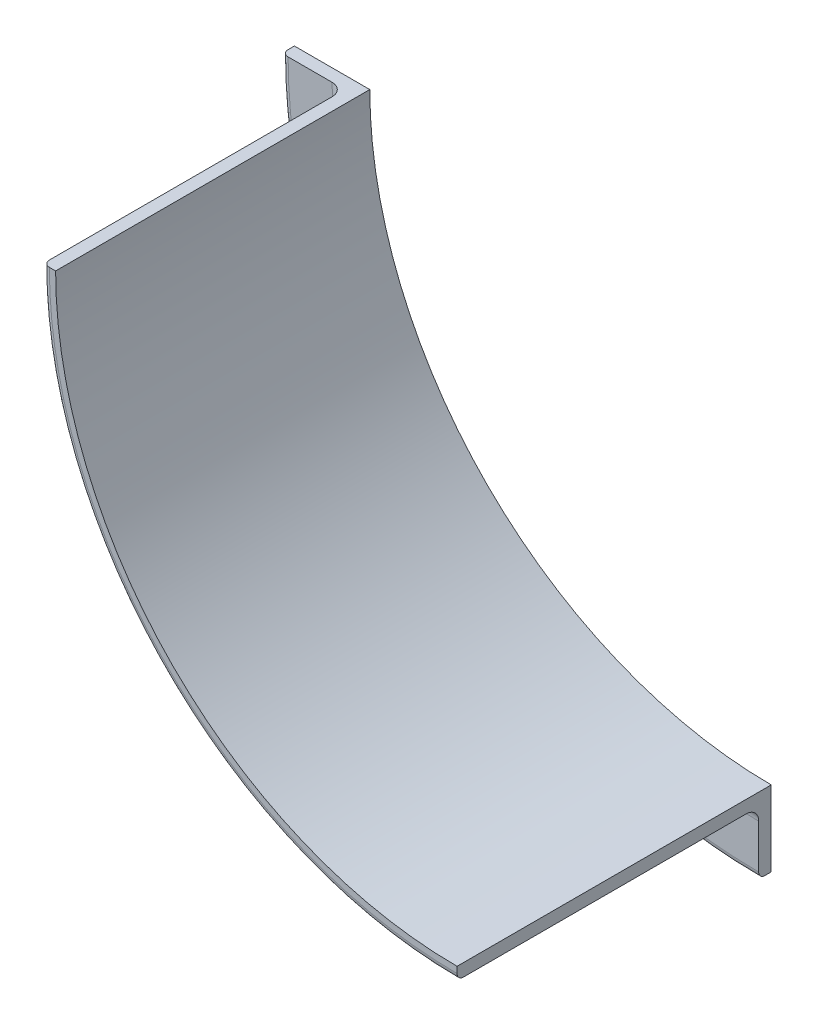
from build123d import *

# Parameters (mm, degrees)
BOSS_EXTRUDE1_DEPTH = 50
CUT_EXTRUDE1_DEPTH  = 48
FILLET1_R           = 1
FILLET2_R           = 2
SKETCH4_R           = 1.6
CUT_EXTRUDE2_DEPTH  = 2921.7864791


with BuildPart() as part:
    # Sketch2 → Boss-Extrude1 (new body)
    with BuildSketch(Plane.XY):
        with BuildLine():
            Line((2758.968126944, -672.549477124), (2746.968126944, -672.549477124))
            ThreePointArc((2746.968126944, -672.549477124), (2769.195793319, -726.211810748), (2822.858126944, -748.439477124))
            Line((2822.858126944, -748.439477124), (2822.858126944, -736.439477124))
            ThreePointArc((2822.858126944, -736.439477124), (2777.681074694, -717.726529374), (2758.968126944, -672.549477124))
        make_face()
    extrude(amount=BOSS_EXTRUDE1_DEPTH)

    # Sketch3 → Cut-Extrude1 (cut)
    with BuildSketch(Plane.XY.offset(50)):
        with BuildLine():
            Line((2756.968126944, -672.549477124), (2737.478838536, -672.549477124))
            Line((2737.478838536, -672.549477124), (2737.478838536, -757.577335174))
            Line((2737.478838536, -757.577335174), (2822.858126944, -757.577335174))
            Line((2822.858126944, -757.577335174), (2822.858126944, -738.439477124))
            ThreePointArc((2822.858126944, -738.439477124), (2776.266861131, -719.140742936), (2756.968126944, -672.549477124))
        make_face()
    extrude(amount=-CUT_EXTRUDE1_DEPTH, mode=Mode.SUBTRACT)

    # Fillet1
    fillet1_edges = [part.edges().sort_by_distance(p)[0] for p in [
        (2776.266861131, -719.140742936, 50),
        (2769.195793319, -726.211810748, 2),
    ]]
    fillet(fillet1_edges, radius=FILLET1_R)

    # Fillet2
    fillet2_edges = [part.edges().sort_by_distance(p)[0] for p in [
        (2776.266861131, -719.140742936, 2),
    ]]
    fillet(fillet2_edges, radius=FILLET2_R)

    # Sketch4 → Cut-Extrude2 (cut, through all)
    with BuildSketch(Plane.XY.offset(2)):
        with Locations((2802.858126944, -741.0807262)):
            Circle(SKETCH4_R)
        with Locations((2754.326877867, -692.549477124)):
            Circle(SKETCH4_R)
    extrude(amount=-CUT_EXTRUDE2_DEPTH, mode=Mode.SUBTRACT)


solid = part.part
